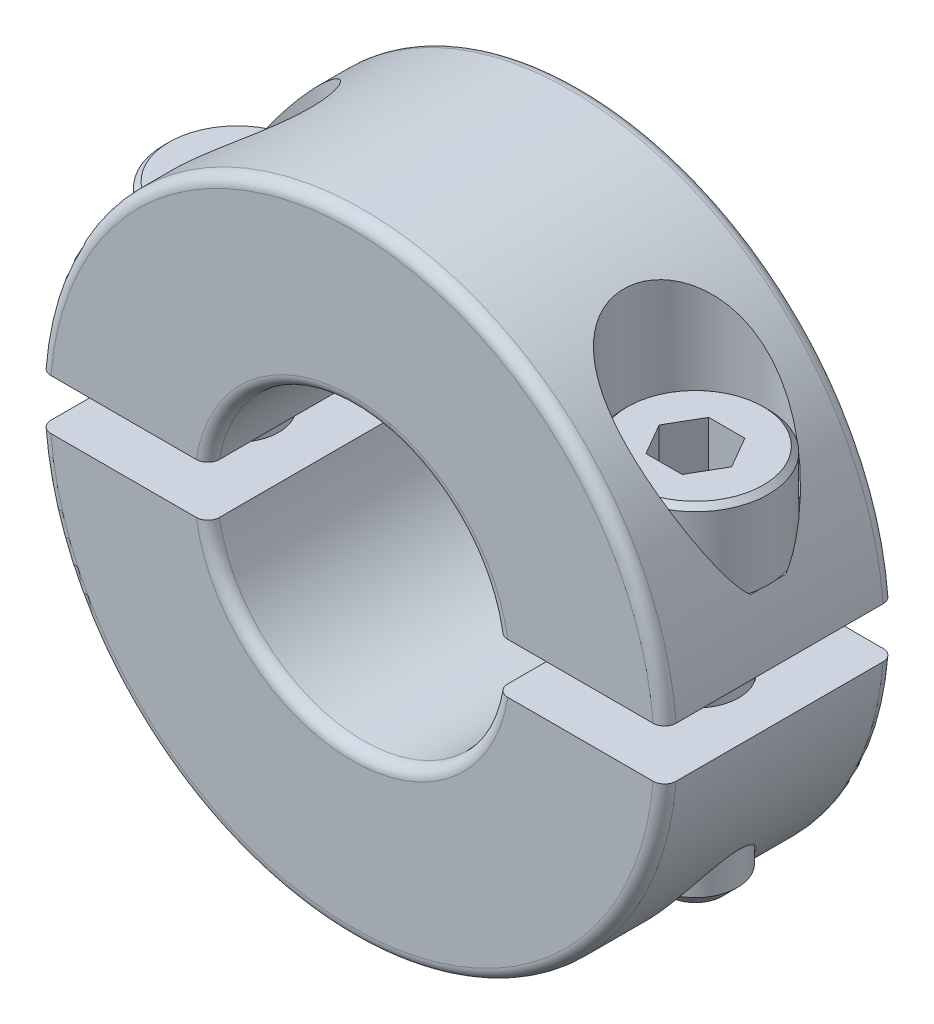
from build123d import *

# Parameters (mm, degrees)
EXTRUDE1_DEPTH     = 5.5
EXTRUDE1_2_DEPTH   = 5.5
FILLET1_R          = 0.55
FILLET2_R          = 0.55
SKETCH8_R          = 2
CUT_EXTRUDE3_DEPTH = 25.948948033
CUT_EXTRUDE2_DEPTH = 3
CHAMFER1_SIZE      = 0.254
CHAMFER2_SIZE      = 0.7
LPATTERN1_COUNT    = 2
LPATTERN1_PITCH    = 21.924149407


with BuildPart() as part:
    # Sketch1 → Extrude1 (new, symmetric)
    with BuildSketch(Plane.XY):
        with BuildLine():
            Line((-14.951922953, 1.2), (-6.89637586, 1.2))
            ThreePointArc((-6.89637586, 1.2), (0, 7), (6.89637586, 1.2))
            Line((6.89637586, 1.2), (14.951922953, 1.2))
            ThreePointArc((14.951922953, 1.2), (0, 15), (-14.951922953, 1.2))
        make_face()
    extrude(amount=EXTRUDE1_DEPTH, both=True)

    # Fillet1
    fillet1_edges = [part.edges().sort_by_distance(p)[0] for p in [
        (0, 7, 5.5),
        (0, 7, -5.5),
        (0, 15, -5.5),
        (0, 15, 5.5),
    ]]
    fillet(fillet1_edges, radius=FILLET1_R)


with BuildPart() as body_2:
    # Sketch1 → Extrude1 2 (new, symmetric)
    with BuildSketch(Plane.XY):
        with BuildLine():
            Line((-14.951922953, -1.2), (-6.89637586, -1.2))
            ThreePointArc((-6.89637586, -1.2), (0, -7), (6.89637586, -1.2))
            Line((6.89637586, -1.2), (14.951922953, -1.2))
            ThreePointArc((14.951922953, -1.2), (0, -15), (-14.951922953, -1.2))
        make_face()
    extrude(amount=EXTRUDE1_2_DEPTH, both=True)

    # Fillet2
    fillet2_edges = [body_2.edges().sort_by_distance(p)[0] for p in [
        (0, -15, 5.5),
        (0, -7, 5.5),
        (0, -7, -5.5),
        (0, -15, -5.5),
    ]]
    fillet(fillet2_edges, radius=FILLET2_R)


with BuildPart() as cut_revolve1_tool:
    # Sketch2 → Cut-Revolve1 (revolve)
    with BuildSketch(Plane(origin=(0, 0, 0), x_dir=(1, 0, 0), z_dir=(0, 1, 0))):
        with BuildLine():
            Line((-11.1905, 5.5), (-10.8095, 5.5))
            ThreePointArc((-10.8095, 5.5), (-11, 5.3095), (-11.1905, 5.5))
        make_face()
    revolve(axis=Axis((0, 0, -5.5), (0, 0, 1)))


with BuildPart() as part_1:
    add(part.part)

    # Cut-Revolve1: cut by cut_revolve1_tool
    add(cut_revolve1_tool.part, mode=Mode.SUBTRACT)


with BuildPart() as body_2_1:
    add(body_2.part)

    # Cut-Revolve1: cut by cut_revolve1_tool
    add(cut_revolve1_tool.part, mode=Mode.SUBTRACT)


with BuildPart() as cut_revolve2_tool:
    # Sketch3 → Cut-Revolve2 (revolve)
    with BuildSketch(Plane.XY):
        Polygon((-11, 15), (-7.4975, 15), (-7.4975, 4.2), (-9, 4.2), (-9, -15), (-11, -15), align=None)
    cut_revolve2 = revolve(axis=Axis((-11, -15, 0), (0, 1, 0)))


with BuildPart() as part_2:
    add(part_1.part)

    # Cut-Revolve2: cut by cut_revolve2_tool
    add(cut_revolve2_tool.part, mode=Mode.SUBTRACT)

    # Mirror1: Cut-Revolve2 across plane
    add(cut_revolve2.mirror(Plane(origin=(0, 0, 0), x_dir=(0, 0, 1), z_dir=(1, 0, 0))), mode=Mode.SUBTRACT)


with BuildPart() as body_2_2:
    add(body_2_1.part)

    # Cut-Revolve2: cut by cut_revolve2_tool
    add(cut_revolve2_tool.part, mode=Mode.SUBTRACT)

    # Sketch8 → Cut-Extrude3 (cut, through all)
    with BuildSketch(Plane(origin=(0, 4.2, 0), x_dir=(1, 0, 0), z_dir=(0, 1, 0))):
        with Locations((11, 0)):
            Circle(SKETCH8_R)
    extrude(amount=-CUT_EXTRUDE3_DEPTH, mode=Mode.SUBTRACT)


with BuildPart() as body_3:
    # Sketch4 → Revolve1 (revolve)
    with BuildSketch(Plane.XY):
        Polygon((-11, 8.2), (-7.5, 8.2), (-7.5, 4.2), (-9, 4.2), (-9, -9.8), (-11, -9.8), align=None)
    revolve(axis=Axis((-11, -9.8, 0), (0, 1, 0)))

    # Sketch5 → Cut-Extrude2 (cut)
    with BuildSketch(Plane(origin=(0, 8.2, 0), x_dir=(-1, 0, 0), z_dir=(0, 1, 0))):
        Polygon((11.866025404, -1.5), (12.732050808, 0), (11.866025404, 1.5), (10.133974596, 1.5), (9.267949192, 0), (10.133974596, -1.5), align=None)
    extrude(amount=-CUT_EXTRUDE2_DEPTH, mode=Mode.SUBTRACT)

    # Chamfer1
    chamfer1_edges = [body_3.edges().sort_by_distance(p)[0] for p in [
        (-14.5, 8.2, 0),
    ]]
    chamfer(chamfer1_edges, length=CHAMFER1_SIZE)

    # Chamfer2
    chamfer2_edges = [body_3.edges().sort_by_distance(p)[0] for p in [
        (-13, -9.8, 0),
    ]]
    chamfer(chamfer2_edges, length=CHAMFER2_SIZE)


with BuildPart() as lpattern1_1:
    # LPattern1: pattern copy
    add(body_3.part.moved(Location(Vector(1, 0, 0) * (1 * LPATTERN1_PITCH))))


solid = Compound([part_2.part, body_2_2.part, body_3.part, lpattern1_1.part])
